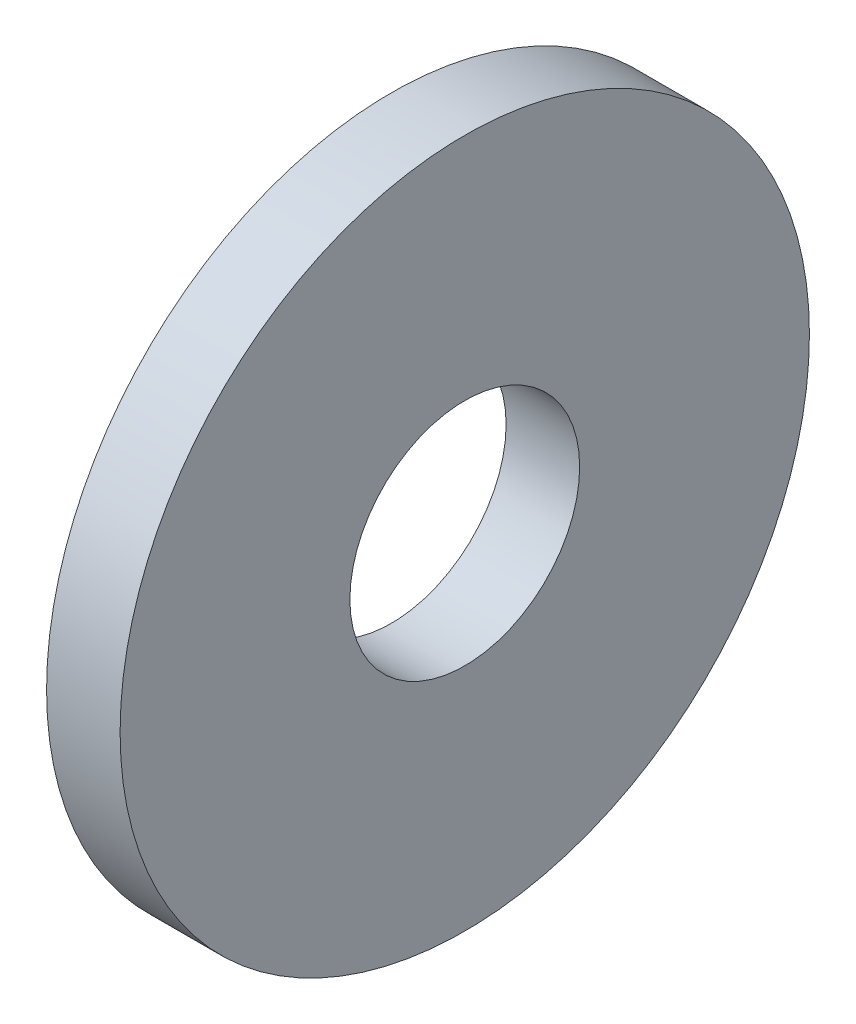
from build123d import *

# Parameters (mm, degrees)
SKETCH1_W = 1.016
SKETCH1_H = 3.175


with BuildPart() as part:
    # Sketch1 → Base-Revolve (revolve)
    with BuildSketch(Plane.XY, mode=Mode.PRIVATE) as base_revolve_sk:
        with Locations((-0.508, 3.175)):
            Rectangle(SKETCH1_W, SKETCH1_H)
    revolve(base_revolve_sk.sketch.rotate(Axis((-34.925, 0, 0), (1, 0, 0)), 90), axis=Axis((-34.925, 0, 0), (1, 0, 0)))


solid = part.part
